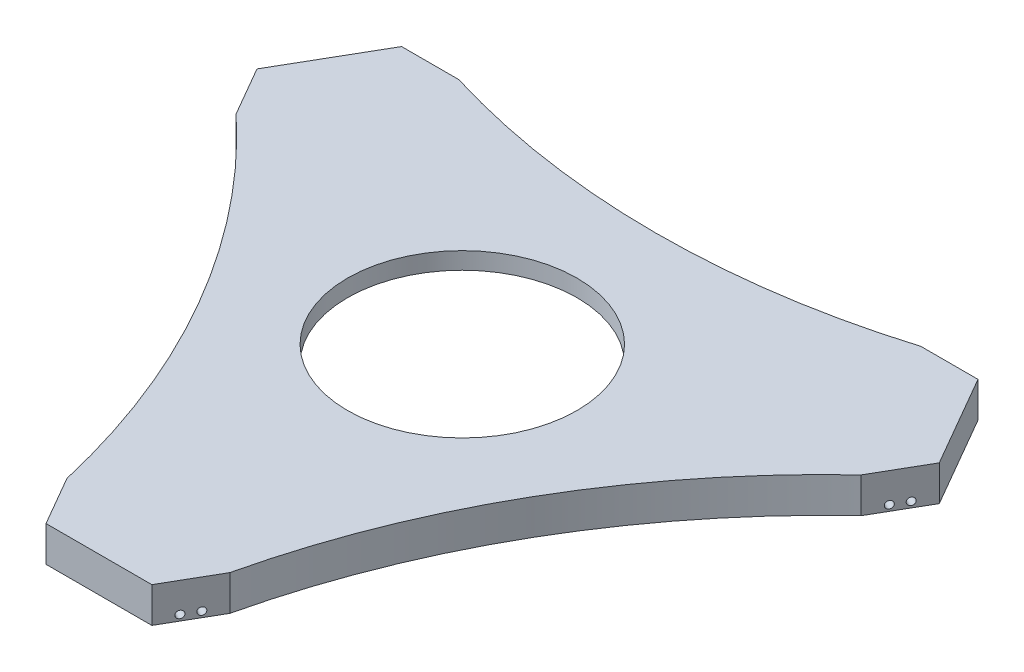
from build123d import *

# Parameters (mm, degrees)
BOSS_EXTRUDE2_DEPTH = 5.4
SKETCH24_R          = 50
CUT_EXTRUDE1_DEPTH  = 342.837952203
SKETCH26_R          = 1.6
CUT_EXTRUDE2_DEPTH  = 8.2
SKETCH27_R          = 1.6
CUT_EXTRUDE3_DEPTH  = 8.2
SKETCH28_R          = 1.6
CUT_EXTRUDE4_DEPTH  = 8.2
SKETCH29_R          = 1.6
CUT_EXTRUDE5_DEPTH  = 8.2
SKETCH30_R          = 1.6
CUT_EXTRUDE6_DEPTH  = 8.2
SKETCH31_R          = 1.6
CUT_EXTRUDE7_DEPTH  = 8.2
SKETCH32_R          = 50
BOSS_EXTRUDE3_DEPTH = 10
CUT_EXTRUDE10_DEPTH = 8


with BuildPart() as part:
    # Sketch1 → Boss-Extrude2 (new body)
    with BuildSketch(Plane(origin=(0, 0, 0), x_dir=(1, 0, 0), z_dir=(0, 1, 0))):
        with BuildLine():
            Line((-213.563400388, 37.399198664), (-226.012295427, 37.399198664))
            Line((-226.012295427, 37.399198664), (-238.461190465, 37.399198664))
            Line((-238.461190465, 37.399198664), (-261.523434509, -2.545779757))
            Line((-261.523434509, -2.545779757), (-255.29898699, -13.326839109))
            Line((-255.29898699, -13.326839109), (-249.074539471, -24.107898462))
            ThreePointArc((-249.074539471, -24.107898462), (-185.740063438, -103.806428821), (-148.38634952, -198.50495918))
            Line((-148.38634952, -198.50495918), (-142.161902, -209.286018532))
            Line((-142.161902, -209.286018532), (-135.937454481, -220.067077885))
            Line((-135.937454481, -220.067077885), (-89.812966393, -220.067077885))
            Line((-89.812966393, -220.067077885), (-83.588518873, -209.286018532))
            Line((-83.588518873, -209.286018532), (-77.364071354, -198.50495918))
            ThreePointArc((-77.364071354, -198.50495918), (-40.010357435, -103.806428821), (23.324118597, -24.107898462))
            Line((23.324118597, -24.107898462), (29.548566116, -13.326839109))
            Line((29.548566116, -13.326839109), (35.773013636, -2.545779757))
            Line((35.773013636, -2.545779757), (12.710769592, 37.399198664))
            Line((12.710769592, 37.399198664), (0.261874553, 37.399198664))
            Line((0.261874553, 37.399198664), (-12.187020486, 37.399198664))
            ThreePointArc((-12.187020486, 37.399198664), (-112.875210437, 22.399198664), (-213.563400388, 37.399198664))
        make_face()
    extrude(amount=BOSS_EXTRUDE2_DEPTH)

    # Sketch24 → Cut-Extrude1 (cut, through all)
    with BuildSketch(Plane(origin=(0, 5.4, 0), x_dir=(1, 0, 0), z_dir=(0, 1, 0))):
        with Locations(Location((-112.875210437, -61.737886326, 0), (0, 0, 270))):
            Circle(SKETCH24_R)
    extrude(amount=-CUT_EXTRUDE1_DEPTH, mode=Mode.SUBTRACT)

    # Sketch26 → Cut-Extrude2 (cut)
    with BuildSketch(Plane(origin=(-197.244930853, 0, 113.879413924), x_dir=(0.5000000000000135, 0, 0.8660254037844309), z_dir=(-0.8660254037844309, 0, 0.5000000000000135))):
        with Locations((106.666057706, 2.5)):
            Circle(SKETCH26_R)
        with Locations((113.666057706, 2.5)):
            Circle(SKETCH26_R)
    extrude(amount=-CUT_EXTRUDE2_DEPTH, mode=Mode.SUBTRACT)

    # Sketch27 → Cut-Extrude3 (cut)
    with BuildSketch(Plane(origin=(-197.244930853, 0, 113.879413924), x_dir=(0.5000000000000427, 0, 0.8660254037844141), z_dir=(-0.8660254037844141, 0, 0.5000000000000427))):
        with Locations((-119.608112274, 2.5)):
            Circle(SKETCH27_R)
        with Locations((-112.608112274, 2.5)):
            Circle(SKETCH27_R)
    extrude(amount=-CUT_EXTRUDE3_DEPTH, mode=Mode.SUBTRACT)

    # Sketch28 → Cut-Extrude4 (cut)
    with BuildSketch(Plane(origin=(0, 0, -37.399198664), x_dir=(-1, 0, 0), z_dir=(0, 0, -1))):
        with Locations((222.512295427, 2.5)):
            Circle(SKETCH28_R)
        with Locations((229.512295427, 2.5)):
            Circle(SKETCH28_R)
    extrude(amount=-CUT_EXTRUDE4_DEPTH, mode=Mode.SUBTRACT)

    # Sketch29 → Cut-Extrude5 (cut)
    with BuildSketch(Plane(origin=(0, 0, -37.399198664), x_dir=(-1, 0, 0), z_dir=(0, 0, -1))):
        with Locations((-3.761874553, 2.5)):
            Circle(SKETCH29_R)
        with Locations((3.238125447, 2.5)):
            Circle(SKETCH29_R)
    extrude(amount=-CUT_EXTRUDE5_DEPTH, mode=Mode.SUBTRACT)

    # Sketch30 → Cut-Extrude6 (cut)
    with BuildSketch(Plane(origin=(27.932115198, 0, 16.126614228), x_dir=(0.5000000000001847, 0, -0.8660254037843321), z_dir=(0.866025403784332, 0, 0.5000000000001846))):
        with Locations((-0.267098163, 2.5)):
            Circle(SKETCH30_R)
        with Locations((6.732901837, 2.5)):
            Circle(SKETCH30_R)
    extrude(amount=-CUT_EXTRUDE6_DEPTH, mode=Mode.SUBTRACT)

    # Sketch31 → Cut-Extrude7 (cut)
    with BuildSketch(Plane(origin=(27.932115198, 0, 16.126614228), x_dir=(0.5000000000000033, 0, -0.8660254037844368), z_dir=(0.8660254037844367, 0, 0.5000000000000032))):
        with Locations((-226.541268142, 2.5)):
            Circle(SKETCH31_R)
        with Locations((-219.541268142, 2.5)):
            Circle(SKETCH31_R)
    extrude(amount=-CUT_EXTRUDE7_DEPTH, mode=Mode.SUBTRACT)

    # Sketch32 → Boss-Extrude3 (add)
    with BuildSketch(Plane(origin=(0, 5.4, 0), x_dir=(1, 0, 0), z_dir=(0, 1, 0))):
        with BuildLine():
            Line((-226.012295427, 37.399198664), (-213.563400388, 37.399198664))
            ThreePointArc((-213.563400388, 37.399198664), (-112.875210437, 22.399198664), (-12.187020486, 37.399198664))
            Line((-12.187020486, 37.399198664), (0.261874553, 37.399198664))
            Line((0.261874553, 37.399198664), (12.710769592, 37.399198664))
            Line((12.710769592, 37.399198664), (35.773013636, -2.545779757))
            Line((35.773013636, -2.545779757), (29.548566116, -13.326839109))
            Line((29.548566116, -13.326839109), (23.324118597, -24.107898462))
            ThreePointArc((23.324118597, -24.107898462), (-40.010357435, -103.806428821), (-77.364071354, -198.50495918))
            Line((-77.364071354, -198.50495918), (-83.588518873, -209.286018532))
            Line((-83.588518873, -209.286018532), (-89.812966393, -220.067077885))
            Line((-89.812966393, -220.067077885), (-135.937454481, -220.067077885))
            Line((-135.937454481, -220.067077885), (-142.161902, -209.286018532))
            Line((-142.161902, -209.286018532), (-148.38634952, -198.50495918))
            ThreePointArc((-148.38634952, -198.50495918), (-185.740063438, -103.806428821), (-249.074539471, -24.107898462))
            Line((-249.074539471, -24.107898462), (-255.29898699, -13.32683911))
            Line((-255.29898699, -13.32683911), (-261.523434509, -2.545779757))
            Line((-261.523434509, -2.545779757), (-238.461190465, 37.399198664))
            Line((-238.461190465, 37.399198664), (-226.012295427, 37.399198664))
        make_face()
        with Locations(Location((-112.875210437, -61.737886326, 0), (0, 0, 270))):
            Circle(SKETCH32_R, mode=Mode.SUBTRACT)
    extrude(amount=BOSS_EXTRUDE3_DEPTH)

    # Sketch36 → Cut-Extrude10 (cut)
    with BuildSketch(Plane.XZ):
        Polygon((-126.824859873, 209.850554734), (-137.330315468, 191.654571888), (-164.323687679, 91.441678511), (-237.613913024, 17.958285754), (-248.119368619, -0.237697092), (-234.169719182, -24.399198664), (-213.158807994, -24.399198664), (-112.875210437, 2.330301956), (-12.59161288, -24.399198664), (8.419298308, -24.399198664), (22.368947745, -0.237697092), (11.863492151, 17.958285754), (-61.426733195, 91.441678511), (-88.420105406, 191.654571888), (-98.925561, 209.850554734), align=None)
    extrude(amount=-CUT_EXTRUDE10_DEPTH, mode=Mode.SUBTRACT)


solid = part.part
